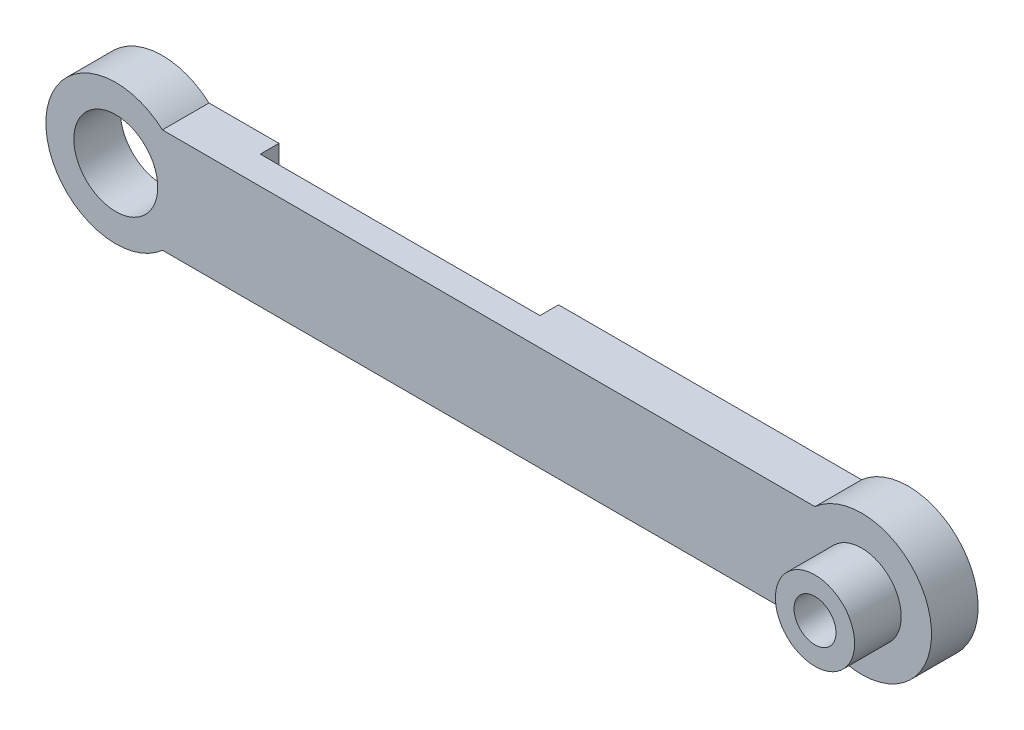
from build123d import *

# Parameters (mm, degrees)
SKETCH_1_R          = 4.5
EXTRUDE_1_DEPTH     = 5
SKETCH_2_R          = 4.25
EXTRUDE_2_DEPTH     = 5
SKETCH_3_R          = 2.25
CUT_EXTRUDE_1_DEPTH = 18
CUT_EXTRUDE_2_REACH = 91.037
SKETCH_4_W          = 30
SKETCH_4_H          = 2


with BuildPart() as part:
    # 스케치1 → 보스-돌출1 (new body)
    with BuildSketch(Plane.XY):
        with BuildLine():
            Line((5, 5.590169944), (75, 5.590169944))
            ThreePointArc((75, 5.590169944), (87.5, 0), (75, -5.590169944))
            Line((75, -5.590169944), (5, -5.590169944))
            ThreePointArc((5, -5.590169944), (-7.5, 0), (5, 5.590169944))
        make_face()
        Circle(SKETCH_1_R, mode=Mode.SUBTRACT)
    extrude(amount=EXTRUDE_1_DEPTH)

    # 스케치2 → 보스-돌출2 (add)
    with BuildSketch(Plane.XY.offset(5)):
        with Locations((80, 0)):
            Circle(SKETCH_2_R)
    extrude(amount=EXTRUDE_2_DEPTH)

    # 스케치3 → 컷-돌출1 (cut)
    with BuildSketch(Plane.XY.offset(10)):
        with Locations((80, 0)):
            Circle(SKETCH_3_R)
    extrude(amount=-CUT_EXTRUDE_1_DEPTH, mode=Mode.SUBTRACT)

    # 스케치4 → 컷-돌출2 (cut, up to next)
    with BuildSketch(Plane(origin=(0, 5.590169944, 0), x_dir=(1, 0, 0), z_dir=(0, 1, 0)), mode=Mode.PRIVATE) as cut_extrude_2_sk1:
        with Locations((27.5, -1)):
            Rectangle(SKETCH_4_W, SKETCH_4_H)
    cut_extrude_2_tool1 = extrude(cut_extrude_2_sk1.sketch, amount=-CUT_EXTRUDE_2_REACH, mode=Mode.PRIVATE) & part.part
    add(cut_extrude_2_tool1.solids().sort_by_distance((27.5, 5.59017, 1))[0], mode=Mode.SUBTRACT)


solid = part.part
